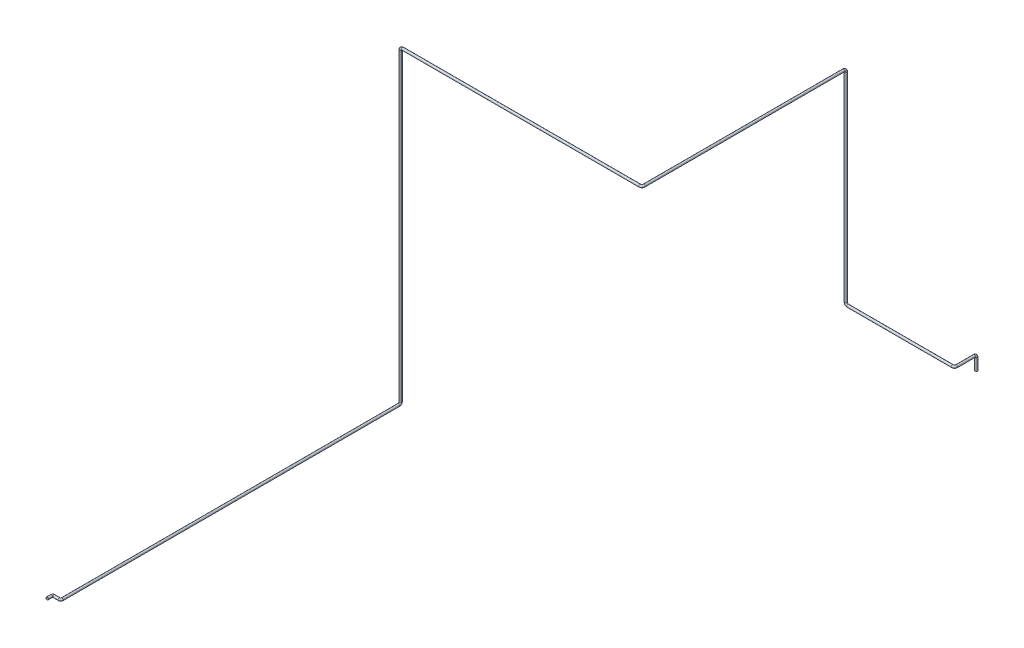
from build123d import *

# Parameters (mm, degrees)
CROQUIS1_R              = 17.5
SALIENTE_EXTRUIR1_DEPTH = 30
CROQUIS2_R              = 17.5


with BuildPart() as part:
    # Croquis1 → Saliente-Extruir1 (new body)
    with BuildSketch(Plane.XY):
        Circle(CROQUIS1_R)
    extrude(amount=-SALIENTE_EXTRUIR1_DEPTH)

    # Barrer1: sweep along a curve in space
    with BuildLine() as barrer1_path:
        Line((0, 0, -30), (0, 0, -60))
        ThreePointArc((0, 0, -60), (5.857864376, 0, -74.142135624), (20, 0, -80))
        Line((20, 0, -80), (100, 0, -80))
        ThreePointArc((100, 0, -80), (114.142135624, 0, -85.857864376), (120, 0, -100))
        Line((120, 0, -100), (120, 0, -5050))
        ThreePointArc((120, 0, -5050), (120, 8.786796564, -5071.213203436), (120, 30, -5080))
        Line((120, 30, -5080), (120, 4510, -5080))
        ThreePointArc((120, 4510, -5080), (128.786796564, 4531.213203436, -5080), (150, 4540, -5080))
        Line((150, 4540, -5080), (3640, 4540, -5080))
        ThreePointArc((3640, 4540, -5080), (3661.213203436, 4540, -5088.786796564), (3670, 4540, -5110))
        Line((3670, 4540, -5110), (3670, 4540, -8050))
        ThreePointArc((3670, 4540, -8050), (3670, 4531.213203436, -8071.213203436), (3670, 4510, -8080))
        Line((3670, 4510, -8080), (3670, 1570, -8080))
        ThreePointArc((3670, 1570, -8080), (3678.786796564, 1548.786796564, -8080), (3700, 1540, -8080))
        Line((3700, 1540, -8080), (5240, 1540, -8080))
        ThreePointArc((5240, 1540, -8080), (5261.213203436, 1540, -8088.786796564), (5270, 1540, -8110))
        Line((5270, 1540, -8110), (5270, 1540, -8370))
        ThreePointArc((5270, 1540, -8370), (5270, 1531.213203436, -8391.213203436), (5270, 1510, -8400))
        Line((5270, 1510, -8400), (5270, 1340, -8400))
    # Croquis2 → Barrer1 (sweep)
    with BuildSketch(Plane(origin=(0, 0, -30), x_dir=(-1, 0, 0), z_dir=(0, 0, -1))):
        Circle(CROQUIS2_R)
    sweep(path=barrer1_path.line)


solid = part.part
